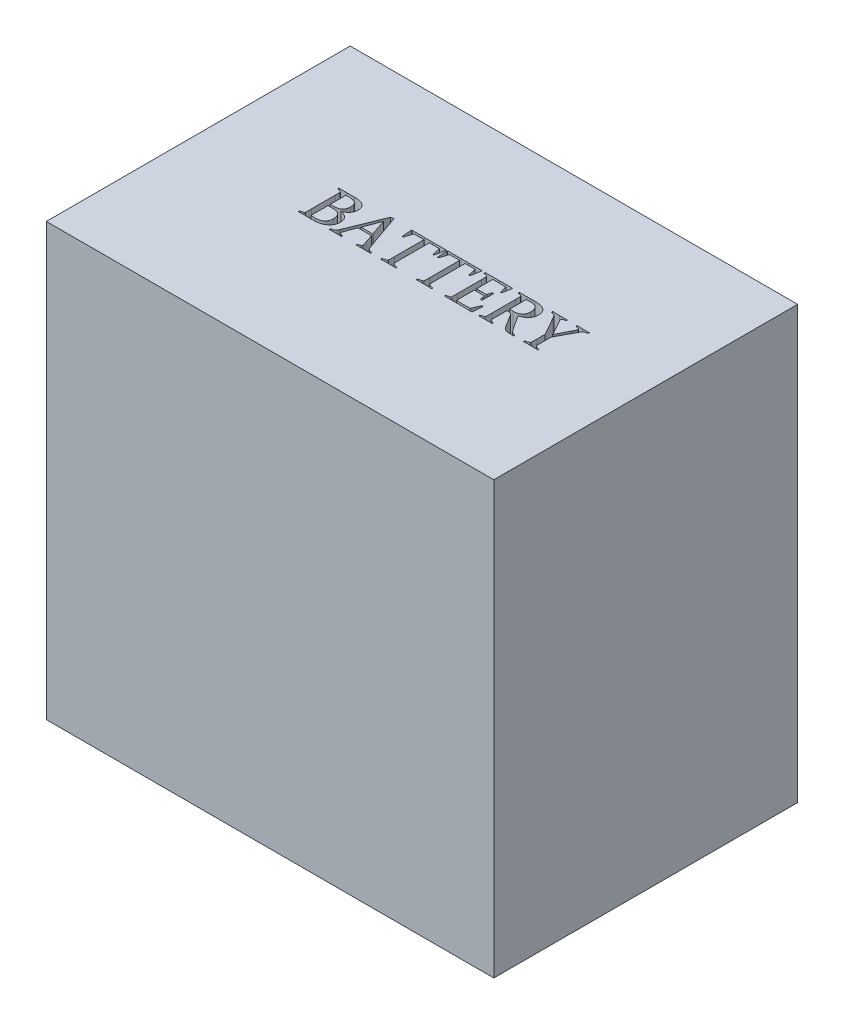
from build123d import *

# Parameters (mm, degrees)
SKETCH1_W           = 140
SKETCH1_H           = 95.06
BOSS_EXTRUDE1_DEPTH = 135
CUT_EXTRUDE1_DEPTH  = 10


with BuildPart() as part:
    # Sketch1 → Boss-Extrude1 (new body)
    with BuildSketch(Plane(origin=(0, 0, 0), x_dir=(1, 0, 0), z_dir=(0, 1, 0))):
        with Locations((-34.524886878, -45.795791855)):
            Rectangle(SKETCH1_W, SKETCH1_H)
    extrude(amount=BOSS_EXTRUDE1_DEPTH)

    # Sketch3 → Cut-Extrude1 (cut)
    # profile 1 of 7: a face of its own
    with BuildSketch(Plane(origin=(0, 135, 0), x_dir=(1, 0, 0), z_dir=(0, 1, 0))):
        with BuildLine():
            add(Edge.make_bspline(
                [(-67.809019882, -38.536040297), (-67.427547121, -38.546417855), (-66.669108469, -38.567050367), (-65.910393126, -38.569341939), (-65.533289712, -38.570480917)],
                knots=[0, 0, 0, 0, 1.005942301, 2, 2, 2, 2], degree=3))
            add(Edge.make_bspline(
                [(-65.533289712, -38.570480917), (-65.451169222, -38.567544733), (-65.264892055, -38.560884471), (-64.953094953, -38.557151408), (-64.57514416, -38.551262412), (-64.155660359, -38.547033522), (-63.740624652, -38.540800795), (-63.380303502, -38.539506194), (-63.096843529, -38.535502588), (-62.934348381, -38.535880219), (-62.865466334, -38.536040297)],
                knots=[0, 0, 0, 0, 0.73913045, 1.676598947, 2.80468887, 4.139292672, 5.450067671, 6.538357173, 7.380406424, 8, 8, 8, 8], degree=3))
            add(Edge.make_bspline(
                [(-62.865466334, -38.536040297), (-62.703774907, -38.537430001), (-62.390525449, -38.540122314), (-61.936010606, -38.579154485), (-61.51145673, -38.636757738), (-61.11549324, -38.713545577), (-60.751950727, -38.820593897), (-60.417858436, -38.947108155), (-60.114448975, -39.097674369), (-59.842426737, -39.272850081), (-59.603227642, -39.47091103), (-59.389655057, -39.68488596), (-59.215935664, -39.926858102), (-59.067795267, -40.183925865), (-58.955693763, -40.464150085), (-58.877496749, -40.764124192), (-58.828406865, -41.084806574), (-58.822864742, -41.305236873), (-58.820018173, -41.418455228)],
                knots=[0, 0, 0, 0, 1.378203886, 2.670034086, 3.88606819, 5.030458177, 6.105049954, 7.113226739, 8.072889222, 8.987638, 9.864930817, 10.716848378, 11.557174684, 12.396758562, 13.241257251, 14.12154981, 15.035182359, 16, 16, 16, 16], degree=3))
            add(Edge.make_bspline(
                [(-58.820018173, -41.418455228), (-58.820908478, -41.510408625), (-58.822651146, -41.69039663), (-58.855124518, -41.95465016), (-58.896719198, -42.208981625), (-58.965856813, -42.450581441), (-59.045185739, -42.682889705), (-59.152216652, -42.900353287), (-59.268678788, -43.111588819), (-59.412009446, -43.306468355), (-59.567088476, -43.494858725), (-59.747673955, -43.665206173), (-59.939750318, -43.831257244), (-60.154115788, -43.982707642), (-60.386989663, -44.121775893), (-60.637761757, -44.252780371), (-60.906674727, -44.371789686), (-61.095284608, -44.438948204), (-61.191122367, -44.473073256)],
                knots=[0, 0, 0, 0, 1.057010299, 2.068973867, 3.05944387, 4.018196596, 4.956492417, 5.878980143, 6.802641909, 7.727364617, 8.657429372, 9.605791154, 10.578809353, 11.576753923, 12.620399978, 13.697337371, 14.829955113, 16, 16, 16, 16], degree=3))
            add(Edge.make_bspline(
                [(-61.191122367, -44.473073256), (-61.078616777, -44.493539302), (-60.858163497, -44.533642261), (-60.540869206, -44.61966028), (-60.242552593, -44.719019596), (-59.965316303, -44.839048116), (-59.708370188, -44.976515321), (-59.470457364, -45.13112253), (-59.252059911, -45.303007191), (-59.057015689, -45.494737075), (-58.879663425, -45.69850536), (-58.730153546, -45.919869868), (-58.597763617, -46.151517817), (-58.491555036, -46.398404672), (-58.413000303, -46.660259651), (-58.354917674, -46.934917554), (-58.315856557, -47.222791096), (-58.312870836, -47.419823984), (-58.311356715, -47.519743449)],
                knots=[0, 0, 0, 0, 1.187931728, 2.327737193, 3.413187731, 4.453183684, 5.463269064, 6.438220556, 7.398548252, 8.346117218, 9.276870068, 10.200947513, 11.117336382, 12.046458873, 12.987068854, 13.953690983, 14.962274252, 16, 16, 16, 16], degree=3))
            add(Edge.make_bspline(
                [(-58.311356715, -47.519743449), (-58.315455324, -47.663906306), (-58.323464481, -47.945617211), (-58.385222602, -48.356283724), (-58.487591687, -48.742681266), (-58.634536307, -49.102765096), (-58.821657173, -49.437741294), (-59.050786461, -49.747298609), (-59.3244488, -50.028743356), (-59.634616468, -50.286578643), (-59.98343952, -50.513191887), (-60.363448821, -50.713141377), (-60.776888122, -50.878919717), (-61.221252479, -51.017865636), (-61.69857691, -51.121328396), (-62.207208779, -51.198902245), (-62.747228976, -51.243155497), (-63.117952305, -51.249385008), (-63.307895831, -51.252576755)],
                knots=[0, 0, 0, 0, 0.981867809, 1.918683317, 2.822078413, 3.699124559, 4.561079493, 5.429873538, 6.31493128, 7.229318538, 8.172142545, 9.1436515, 10.15029445, 11.202629439, 12.312014813, 13.474334065, 14.705951703, 16, 16, 16, 16], degree=3))
            add(Edge.make_bspline(
                [(-63.307895831, -51.252576755), (-63.46950963, -51.252288886), (-63.806017329, -51.251689494), (-64.334035588, -51.238597476), (-64.915069564, -51.226400232), (-65.321339055, -51.226193285), (-65.53593899, -51.226083971)],
                knots=[0, 0, 0, 0, 0.870320471, 1.812156761, 2.844336023, 4, 4, 4, 4], degree=3))
            add(Edge.make_bspline(
                [(-65.53593899, -51.226083971), (-65.905970003, -51.226565663), (-66.652275977, -51.227537175), (-67.398397366, -51.244183804), (-67.774579262, -51.252576755)],
                knots=[0, 0, 0, 0, 0.991633528, 2, 2, 2, 2], degree=3))
            Line((-67.774579262, -51.252576755), (-67.809019882, -50.913469116))
            Line((-67.809019882, -50.913469116), (-66.709569334, -50.574361478))
            add(Edge.make_bspline(
                [(-66.709569334, -50.574361478), (-66.675942332, -50.562088632), (-66.612088416, -50.538783872), (-66.534063804, -50.475564404), (-66.482006467, -50.390399903), (-66.473146081, -50.325191923), (-66.468484997, -50.290888686)],
                knots=[0, 0, 0, 0, 1.072356029, 2.036284212, 2.966969876, 4, 4, 4, 4], degree=3))
            add(Edge.make_bspline(
                [(-66.468484997, -50.290888686), (-66.465555591, -50.161961552), (-66.459376186, -49.889997577), (-66.455510446, -49.459012658), (-66.448317011, -48.982164606), (-66.44938214, -48.648339378), (-66.449940048, -48.473483684)],
                knots=[0, 0, 0, 0, 0.851424291, 1.796027954, 2.845572385, 4, 4, 4, 4], degree=3))
            Line((-66.449940048, -48.473483684), (-66.449940048, -41.06080264))
            add(Edge.make_bspline(
                [(-66.449940048, -41.06080264), (-66.449371916, -40.913322078), (-66.44829344, -40.633362171), (-66.455513156, -40.234230992), (-66.459354675, -39.875651885), (-66.465554368, -39.649614983), (-66.468484997, -39.5427661)],
                knots=[0, 0, 0, 0, 1.165661162, 2.212755269, 3.155159611, 4, 4, 4, 4], degree=3))
            add(Edge.make_bspline(
                [(-66.468484997, -39.5427661), (-66.471341905, -39.505942968), (-66.476727369, -39.436528909), (-66.522648151, -39.344665725), (-66.590420393, -39.270774565), (-66.651655601, -39.245678032), (-66.68307655, -39.232800524)],
                knots=[0, 0, 0, 0, 1.089053236, 2.052937975, 3.000925474, 4, 4, 4, 4], degree=3))
            Line((-66.68307655, -39.232800524), (-67.790474933, -38.875147936))
            Line((-67.790474933, -38.875147936), (-67.809019882, -38.536040297))
        make_face()
        with BuildLine():
            Line((-64.754401853, -44.979085436), (-64.754401853, -50.256448066))
            add(Edge.make_bspline(
                [(-64.754401853, -50.256448066), (-64.65605006, -50.284658389), (-64.447929201, -50.34435386), (-64.116843115, -50.382381639), (-63.78142988, -50.397938133), (-63.55959909, -50.402586583), (-63.453606145, -50.404807658)],
                knots=[0, 0, 0, 0, 0.932933746, 1.974168104, 3.032037493, 4, 4, 4, 4], degree=3))
            add(Edge.make_bspline(
                [(-63.453606145, -50.404807658), (-63.330767627, -50.403124731), (-63.091639932, -50.399848604), (-62.744625017, -50.364433136), (-62.419650166, -50.309173621), (-62.116571324, -50.233924872), (-61.83739735, -50.13262053), (-61.580072944, -50.010641728), (-61.346449996, -49.864621599), (-61.135430096, -49.69694897), (-60.948639857, -49.507469505), (-60.786443761, -49.297722805), (-60.650069368, -49.066964092), (-60.539416024, -48.816814182), (-60.450634929, -48.547351348), (-60.391446195, -48.256565414), (-60.353632767, -47.946388047), (-60.348589495, -47.73268453), (-60.346002548, -47.623065308)],
                knots=[0, 0, 0, 0, 1.238057209, 2.410105338, 3.512269806, 4.559560237, 5.553733266, 6.501495605, 7.425414509, 8.325034372, 9.212724115, 10.101350968, 10.991537483, 11.9081781, 12.854182454, 13.846000613, 14.895105975, 16, 16, 16, 16], degree=3))
            add(Edge.make_bspline(
                [(-60.346002548, -47.623065308), (-60.348666269, -47.513466888), (-60.353837904, -47.300680758), (-60.390188275, -46.99261248), (-60.454165101, -46.707042144), (-60.54138696, -46.443090734), (-60.652717878, -46.199583246), (-60.790592681, -45.977805268), (-60.957241654, -45.780737435), (-61.146884547, -45.603583227), (-61.365399797, -45.448568437), (-61.612601292, -45.312285035), (-61.893430381, -45.203620437), (-62.202153165, -45.109610008), (-62.542989393, -45.040393906), (-62.913422688, -44.986464976), (-63.315433327, -44.959112307), (-63.59310161, -44.954818887), (-63.737078937, -44.952592652)],
                knots=[0, 0, 0, 0, 1.05999139, 2.057980992, 2.994616073, 3.885952831, 4.742010155, 5.578585574, 6.403171339, 7.231156379, 8.082085007, 8.988034817, 9.953965965, 10.988883383, 12.106237805, 13.314170885, 14.607336449, 16, 16, 16, 16], degree=3))
            add(Edge.make_bspline(
                [(-63.737078937, -44.952592652), (-63.90843494, -44.952984912), (-64.247753603, -44.953761665), (-64.586648806, -44.970700645), (-64.754401853, -44.979085436)],
                knots=[0, 0, 0, 0, 1.010000458, 2, 2, 2, 2], degree=3))
        make_face(mode=Mode.SUBTRACT)
        with BuildLine():
            add(Edge.make_bspline(
                [(-64.754401853, -44.292922323), (-64.562772242, -44.294910272), (-64.177753045, -44.29890443), (-63.79271534, -44.300212921), (-63.599316458, -44.300870158)],
                knots=[0, 0, 0, 0, 0.995428867, 2, 2, 2, 2], degree=3))
            add(Edge.make_bspline(
                [(-63.599316458, -44.300870158), (-63.489755054, -44.298676327), (-63.276415266, -44.294404464), (-62.967193463, -44.26605633), (-62.678234196, -44.215867258), (-62.410614699, -44.144489167), (-62.162982894, -44.054589507), (-61.935589601, -43.946248387), (-61.729902543, -43.815727805), (-61.546170365, -43.663882675), (-61.383694839, -43.49228408), (-61.23909712, -43.304521638), (-61.120074181, -43.09522154), (-61.021316985, -42.869924216), (-60.948054208, -42.624865793), (-60.891889207, -42.363768167), (-60.860488447, -42.083304966), (-60.856643088, -41.890984575), (-60.854664006, -41.792003486)],
                knots=[0, 0, 0, 0, 1.237178968, 2.409055454, 3.502577501, 4.545123155, 5.532558798, 6.47363837, 7.383776903, 8.276262588, 9.157930545, 10.047458661, 10.94544277, 11.869891171, 12.819334189, 13.828534526, 14.882416913, 16, 16, 16, 16], degree=3))
            add(Edge.make_bspline(
                [(-60.854664006, -41.792003486), (-60.856276096, -41.688570236), (-60.859386134, -41.489027096), (-60.895044492, -41.201010355), (-60.950057065, -40.934917185), (-61.025416047, -40.689596913), (-61.126835219, -40.468313975), (-61.249664009, -40.269070878), (-61.395865811, -40.093214037), (-61.565819318, -39.940833312), (-61.754868645, -39.808389449), (-61.962790296, -39.693934257), (-62.190537805, -39.598802907), (-62.437516591, -39.518711531), (-62.705703316, -39.459577656), (-62.992226357, -39.414119928), (-63.298556966, -39.387453357), (-63.509188234, -39.385049593), (-63.617861407, -39.383809394)],
                knots=[0, 0, 0, 0, 1.177231098, 2.271110987, 3.298638014, 4.268657357, 5.186615539, 6.062809601, 6.926742094, 7.781081906, 8.65432805, 9.549983417, 10.478238827, 11.460894017, 12.502544614, 13.601957102, 14.762752866, 16, 16, 16, 16], degree=3))
            add(Edge.make_bspline(
                [(-63.617861407, -39.383809394), (-63.700883994, -39.384179564), (-63.874941562, -39.384955627), (-64.146980935, -39.396749909), (-64.443183193, -39.413782186), (-64.647625969, -39.435860873), (-64.754401853, -39.447392077)],
                knots=[0, 0, 0, 0, 0.874677504, 1.83376891, 2.868626, 4, 4, 4, 4], degree=3))
            Line((-64.754401853, -39.447392077), (-64.754401853, -44.292922323))
        make_face(mode=Mode.SUBTRACT)
    # profile 2 of 7: a face of its own
    with BuildSketch(Plane(origin=(0, 135, 0), x_dir=(1, 0, 0), z_dir=(0, 1, 0))):
        with BuildLine():
            Line((-50.890727835, -38.196932658), (-46.922108749, -49.459015259))
            add(Edge.make_bspline(
                [(-46.922108749, -49.459015259), (-46.885663146, -49.556391089), (-46.818572642, -49.735644359), (-46.71727249, -49.97893096), (-46.617774069, -50.169388956), (-46.52207984, -50.317727821), (-46.415151059, -50.430782604), (-46.290833352, -50.520236854), (-46.149463946, -50.598234463), (-46.045791974, -50.636640187), (-45.992212021, -50.656489109)],
                knots=[0, 0, 0, 0, 1.574516787, 2.898432601, 3.987097625, 4.825290635, 5.56306803, 6.327976849, 7.135861677, 8, 8, 8, 8], degree=3))
            Line((-45.992212021, -50.656489109), (-45.14974148, -50.913469116))
            Line((-45.14974148, -50.913469116), (-45.13384581, -51.252576755))
            add(Edge.make_bspline(
                [(-45.13384581, -51.252576755), (-45.325480074, -51.249283394), (-45.70168619, -51.242818045), (-46.255315735, -51.229235603), (-46.787885158, -51.229307688), (-47.13581929, -51.227143899), (-47.306254121, -51.226083971)],
                knots=[0, 0, 0, 0, 1.058612849, 2.078212005, 3.058616038, 4, 4, 4, 4], degree=3))
            add(Edge.make_bspline(
                [(-47.306254121, -51.226083971), (-47.483754084, -51.227132376), (-47.853766087, -51.229317855), (-48.432247844, -51.229365395), (-49.056530067, -51.243051412), (-49.488373005, -51.249328915), (-49.711798935, -51.252576755)],
                knots=[0, 0, 0, 0, 0.885404967, 1.84569315, 2.885409556, 4, 4, 4, 4], degree=3))
            Line((-49.711798935, -51.252576755), (-49.746239554, -50.913469116))
            Line((-49.746239554, -50.913469116), (-48.898470457, -50.645891995))
            add(Edge.make_bspline(
                [(-48.898470457, -50.645891995), (-48.846417956, -50.624085931), (-48.755473136, -50.585986925), (-48.638131491, -50.50604919), (-48.572638726, -50.383620697), (-48.569216995, -50.291741085), (-48.567310653, -50.240552396)],
                knots=[0, 0, 0, 0, 1.191052092, 2.08097623, 2.930858445, 4, 4, 4, 4], degree=3))
            add(Edge.make_bspline(
                [(-48.567310653, -50.240552396), (-48.572947489, -50.165975309), (-48.58588283, -49.994836742), (-48.652354838, -49.773201628), (-48.714787482, -49.559195484), (-48.776571081, -49.365094737), (-48.848566327, -49.145662807), (-48.898557426, -48.990123051), (-48.924963241, -48.907965346)],
                knots=[0, 0, 0, 0, 0.970738523, 2.227638644, 2.994762933, 3.874229025, 4.877145812, 6, 6, 6, 6], degree=3))
            Line((-48.924963241, -48.907965346), (-49.764784503, -46.335515991))
            Line((-49.764784503, -46.335515991), (-54.075160507, -46.335515991))
            Line((-54.075160507, -46.335515991), (-55.013005071, -48.907965346))
            add(Edge.make_bspline(
                [(-55.013005071, -48.907965346), (-55.043443713, -48.993482262), (-55.100759002, -49.154508717), (-55.175727685, -49.384794235), (-55.248445012, -49.583904019), (-55.30857445, -49.758239647), (-55.353100293, -49.910604503), (-55.390319952, -50.043102204), (-55.408792127, -50.16057938), (-55.413516894, -50.233447242), (-55.415695392, -50.26704518)],
                knots=[0, 0, 0, 0, 1.53230722, 2.885300472, 4.087661103, 5.110660653, 5.997387815, 6.767555662, 7.431744164, 8, 8, 8, 8], degree=3))
            add(Edge.make_bspline(
                [(-55.415695392, -50.26704518), (-55.412958036, -50.315859519), (-55.407924413, -50.405622406), (-55.334909342, -50.522500589), (-55.218034627, -50.600003531), (-55.12690818, -50.6346873), (-55.076587753, -50.65383983)],
                knots=[0, 0, 0, 0, 1.036269142, 1.905557071, 2.843439335, 4, 4, 4, 4], degree=3))
            Line((-55.076587753, -50.65383983), (-54.244714326, -50.913469116))
            Line((-54.244714326, -50.913469116), (-54.226169377, -51.252576755))
            add(Edge.make_bspline(
                [(-54.226169377, -51.252576755), (-54.428402486, -51.249383273), (-54.812563624, -51.243316948), (-55.360003404, -51.229442517), (-55.849300338, -51.229348629), (-56.156612074, -51.227125341), (-56.300554387, -51.226083971)],
                knots=[0, 0, 0, 0, 1.169919131, 2.222373308, 3.16737414, 4, 4, 4, 4], degree=3))
            add(Edge.make_bspline(
                [(-56.300554387, -51.226083971), (-56.438314442, -51.227139717), (-56.721781928, -51.229312114), (-57.15898978, -51.229280213), (-57.619878998, -51.242911381), (-57.935155059, -51.249301294), (-58.096765162, -51.252576755)],
                knots=[0, 0, 0, 0, 0.920242704, 1.893574212, 2.920248855, 4, 4, 4, 4], degree=3))
            Line((-58.096765162, -51.252576755), (-58.141802895, -50.913469116))
            Line((-58.141802895, -50.913469116), (-57.238398951, -50.627347046))
            add(Edge.make_bspline(
                [(-57.238398951, -50.627347046), (-57.184475776, -50.609052337), (-57.080899193, -50.573911536), (-56.946307994, -50.490931843), (-56.827133897, -50.402338232), (-56.734518486, -50.285978373), (-56.653174352, -50.147505975), (-56.560107731, -49.986754325), (-56.473542851, -49.788283513), (-56.412616319, -49.646246507), (-56.38003274, -49.570284953)],
                knots=[0, 0, 0, 0, 0.960439586, 1.844829266, 2.664180003, 3.460297701, 4.339620655, 5.383436748, 6.600658962, 8, 8, 8, 8], degree=3))
            Line((-56.38003274, -49.570284953), (-51.812676729, -38.334695136))
            Line((-51.812676729, -38.334695136), (-50.890727835, -38.196932658))
        make_face()
        Polygon((-53.744000703, -45.657300714), (-50.058854409, -45.657300714), (-51.802079615, -40.599828193), align=None, mode=Mode.SUBTRACT)
    # profile 3 of 7: a face of its own
    with BuildSketch(Plane(origin=(0, 135, 0), x_dir=(1, 0, 0), z_dir=(0, 1, 0))):
        with BuildLine():
            add(Edge.make_bspline(
                [(-39.641891627, -51.226083971), (-39.826456241, -51.227137109), (-40.205299181, -51.229298811), (-40.790846489, -51.22931791), (-41.408065797, -51.242879996), (-41.831075724, -51.249295407), (-42.04743644, -51.252576755)],
                knots=[0, 0, 0, 0, 0.920642888, 1.889739583, 2.920646004, 4, 4, 4, 4], degree=3))
            Line((-42.04743644, -51.252576755), (-42.08187706, -50.913469116))
            Line((-42.08187706, -50.913469116), (-40.759887124, -50.508129517))
            add(Edge.make_bspline(
                [(-40.759887124, -50.508129517), (-40.726240452, -50.495956108), (-40.661812626, -50.472646038), (-40.584410998, -50.408074642), (-40.538290198, -50.320246307), (-40.530757514, -50.25611897), (-40.526750622, -50.222007447)],
                knots=[0, 0, 0, 0, 1.07619582, 2.060737424, 2.968439932, 4, 4, 4, 4], degree=3))
            add(Edge.make_bspline(
                [(-40.526750622, -50.222007447), (-40.523817632, -50.096612849), (-40.517580345, -49.829949051), (-40.513784791, -49.406026827), (-40.506567751, -48.933594867), (-40.507641575, -48.602418646), (-40.508205673, -48.42844595)],
                knots=[0, 0, 0, 0, 0.839114093, 1.784457676, 2.836136637, 4, 4, 4, 4], degree=3))
            Line((-40.508205673, -48.42844595), (-40.508205673, -39.214255575))
            Line((-40.508205673, -39.214255575), (-43.66614556, -39.214255575))
            Line((-43.66614556, -39.214255575), (-44.460929089, -41.760212145))
            Line((-44.460929089, -41.760212145), (-44.818581677, -41.826444106))
            Line((-44.818581677, -41.826444106), (-45.051718178, -38.573130195))
            Line((-45.051718178, -38.573130195), (-44.988135496, -38.501599677))
            add(Edge.make_bspline(
                [(-44.988135496, -38.501599677), (-44.625189054, -38.507242887), (-43.907264153, -38.518405417), (-42.842238874, -38.528962511), (-41.801057851, -38.533779174), (-41.11489076, -38.535292434), (-40.775782794, -38.536040297)],
                knots=[0, 0, 0, 0, 1.034026858, 2.045353098, 3.034001568, 4, 4, 4, 4], degree=3))
            Line((-40.775782794, -38.536040297), (-38.444417777, -38.536040297))
            add(Edge.make_bspline(
                [(-38.444417777, -38.536040297), (-38.106192912, -38.535290356), (-37.420025856, -38.533768927), (-36.377078676, -38.528957489), (-35.305872414, -38.518366881), (-34.582648306, -38.507238669), (-34.216169404, -38.501599677)],
                knots=[0, 0, 0, 0, 0.95986119, 1.947299551, 2.95983638, 4, 4, 4, 4], degree=3))
            Line((-34.216169404, -38.501599677), (-34.163183836, -38.573130195))
            Line((-34.163183836, -38.573130195), (-34.724830863, -41.762861423))
            Line((-34.724830863, -41.762861423), (-35.082483451, -41.826444106))
            Line((-35.082483451, -41.826444106), (-35.654727591, -39.214255575))
            Line((-35.654727591, -39.214255575), (-38.812667478, -39.214255575))
            Line((-38.812667478, -39.214255575), (-38.812667478, -48.42844595))
            add(Edge.make_bspline(
                [(-38.812667478, -48.42844595), (-38.813231577, -48.602418646), (-38.8143054, -48.933594867), (-38.80708836, -49.406026827), (-38.803292806, -49.829949051), (-38.797055519, -50.096612849), (-38.794122529, -50.222007447)],
                knots=[0, 0, 0, 0, 1.163863363, 2.215542324, 3.160885907, 4, 4, 4, 4], degree=3))
            add(Edge.make_bspline(
                [(-38.794122529, -50.222007447), (-38.790401467, -50.256298795), (-38.783359717, -50.321191846), (-38.733343407, -50.406365828), (-38.659141201, -50.473567109), (-38.594877685, -50.496195584), (-38.560986028, -50.508129517)],
                knots=[0, 0, 0, 0, 1.033432821, 1.955671374, 2.921850393, 4, 4, 4, 4], degree=3))
            Line((-38.560986028, -50.508129517), (-37.238996092, -50.913469116))
            Line((-37.238996092, -50.913469116), (-37.220451143, -51.252576755))
            add(Edge.make_bspline(
                [(-37.220451143, -51.252576755), (-37.443876967, -51.249322752), (-37.87660257, -51.24302048), (-38.503534708, -51.229350123), (-39.087314912, -51.229315499), (-39.461742397, -51.227133704), (-39.641891627, -51.226083971)],
                knots=[0, 0, 0, 0, 1.107274464, 2.144541755, 3.107278743, 4, 4, 4, 4], degree=3))
        make_face()
    # profile 4 of 7: a face of its own
    with BuildSketch(Plane(origin=(0, 135, 0), x_dir=(1, 0, 0), z_dir=(0, 1, 0))):
        with BuildLine():
            add(Edge.make_bspline(
                [(-28.451339543, -51.226083971), (-28.635904158, -51.227137109), (-29.014747097, -51.229298811), (-29.600294405, -51.22931791), (-30.217513713, -51.242879996), (-30.64052364, -51.249295407), (-30.856884357, -51.252576755)],
                knots=[0, 0, 0, 0, 0.920642888, 1.889739583, 2.920646004, 4, 4, 4, 4], degree=3))
            Line((-30.856884357, -51.252576755), (-30.891324976, -50.913469116))
            Line((-30.891324976, -50.913469116), (-29.56933504, -50.508129517))
            add(Edge.make_bspline(
                [(-29.56933504, -50.508129517), (-29.535688368, -50.495956108), (-29.471260543, -50.472646038), (-29.393858915, -50.408074642), (-29.347738114, -50.320246307), (-29.340205431, -50.25611897), (-29.336198539, -50.222007447)],
                knots=[0, 0, 0, 0, 1.07619582, 2.060737424, 2.968439932, 4, 4, 4, 4], degree=3))
            add(Edge.make_bspline(
                [(-29.336198539, -50.222007447), (-29.333265549, -50.096612849), (-29.327028262, -49.829949051), (-29.323232708, -49.406026827), (-29.316015668, -48.933594867), (-29.317089491, -48.602418646), (-29.31765359, -48.42844595)],
                knots=[0, 0, 0, 0, 0.839114093, 1.784457676, 2.836136637, 4, 4, 4, 4], degree=3))
            Line((-29.31765359, -48.42844595), (-29.31765359, -39.214255575))
            Line((-29.31765359, -39.214255575), (-32.475593477, -39.214255575))
            Line((-32.475593477, -39.214255575), (-33.270377005, -41.760212145))
            Line((-33.270377005, -41.760212145), (-33.628029593, -41.826444106))
            Line((-33.628029593, -41.826444106), (-33.861166095, -38.573130195))
            Line((-33.861166095, -38.573130195), (-33.797583413, -38.501599677))
            add(Edge.make_bspline(
                [(-33.797583413, -38.501599677), (-33.434636971, -38.507242887), (-32.71671207, -38.518405417), (-31.65168679, -38.528962511), (-30.610505768, -38.533779174), (-29.924338677, -38.535292434), (-29.585230711, -38.536040297)],
                knots=[0, 0, 0, 0, 1.034026858, 2.045353098, 3.034001568, 4, 4, 4, 4], degree=3))
            Line((-29.585230711, -38.536040297), (-27.253865693, -38.536040297))
            add(Edge.make_bspline(
                [(-27.253865693, -38.536040297), (-26.915640829, -38.535290356), (-26.229473773, -38.533768927), (-25.186526593, -38.528957489), (-24.115320331, -38.518366881), (-23.392096223, -38.507238669), (-23.025617321, -38.501599677)],
                knots=[0, 0, 0, 0, 0.95986119, 1.947299551, 2.95983638, 4, 4, 4, 4], degree=3))
            Line((-23.025617321, -38.501599677), (-22.972631753, -38.573130195))
            Line((-22.972631753, -38.573130195), (-23.534278779, -41.762861423))
            Line((-23.534278779, -41.762861423), (-23.891931367, -41.826444106))
            Line((-23.891931367, -41.826444106), (-24.464175508, -39.214255575))
            Line((-24.464175508, -39.214255575), (-27.622115395, -39.214255575))
            Line((-27.622115395, -39.214255575), (-27.622115395, -48.42844595))
            add(Edge.make_bspline(
                [(-27.622115395, -48.42844595), (-27.622679493, -48.602418646), (-27.623753317, -48.933594867), (-27.616536277, -49.406026827), (-27.612740723, -49.829949051), (-27.606503436, -50.096612849), (-27.603570446, -50.222007447)],
                knots=[0, 0, 0, 0, 1.163863363, 2.215542324, 3.160885907, 4, 4, 4, 4], degree=3))
            add(Edge.make_bspline(
                [(-27.603570446, -50.222007447), (-27.599849383, -50.256298795), (-27.592807633, -50.321191846), (-27.542791324, -50.406365828), (-27.468589118, -50.473567109), (-27.404325601, -50.496195584), (-27.370433944, -50.508129517)],
                knots=[0, 0, 0, 0, 1.033432821, 1.955671374, 2.921850393, 4, 4, 4, 4], degree=3))
            Line((-27.370433944, -50.508129517), (-26.048444008, -50.913469116))
            Line((-26.048444008, -50.913469116), (-26.029899059, -51.252576755))
            add(Edge.make_bspline(
                [(-26.029899059, -51.252576755), (-26.253324884, -51.249322752), (-26.686050487, -51.24302048), (-27.312982625, -51.229350123), (-27.896762829, -51.229315499), (-28.271190313, -51.227133704), (-28.451339543, -51.226083971)],
                knots=[0, 0, 0, 0, 1.107274464, 2.144541755, 3.107278743, 4, 4, 4, 4], degree=3))
        make_face()
    # profile 5 of 7: a face of its own
    with BuildSketch(Plane(origin=(0, 135, 0), x_dir=(1, 0, 0), z_dir=(0, 1, 0))):
        with BuildLine():
            Line((-19.84118465, -38.536040297), (-17.695269122, -38.536040297))
            add(Edge.make_bspline(
                [(-17.695269122, -38.536040297), (-17.357044258, -38.535290356), (-16.670877202, -38.533768927), (-15.627930022, -38.528957489), (-14.55672376, -38.518366881), (-13.833499652, -38.507238669), (-13.46702075, -38.501599677)],
                knots=[0, 0, 0, 0, 0.95986119, 1.947299551, 2.95983638, 4, 4, 4, 4], degree=3))
            Line((-13.46702075, -38.501599677), (-13.411385903, -38.573130195))
            Line((-13.411385903, -38.573130195), (-13.930644475, -41.418455228))
            Line((-13.930644475, -41.418455228), (-14.288297063, -41.479388631))
            Line((-14.288297063, -41.479388631), (-14.841996254, -39.214255575))
            Line((-14.841996254, -39.214255575), (-18.974870603, -39.214255575))
            Line((-18.974870603, -39.214255575), (-18.974870603, -44.300870158))
            Line((-18.974870603, -44.300870158), (-18.161542126, -44.300870158))
            add(Edge.make_bspline(
                [(-18.161542126, -44.300870158), (-18.001699314, -44.301394222), (-17.674056409, -44.302468439), (-17.168964868, -44.293940117), (-16.637292436, -44.294533173), (-16.273484362, -44.288211952), (-16.087157116, -44.284974488)],
                knots=[0, 0, 0, 0, 0.924608237, 1.895245239, 2.922032839, 4, 4, 4, 4], degree=3))
            add(Edge.make_bspline(
                [(-16.087157116, -44.284974488), (-16.051288761, -44.281949128), (-15.982898129, -44.276180639), (-15.891818244, -44.231608705), (-15.819863627, -44.161530193), (-15.795339237, -44.099981209), (-15.782490097, -44.067733656)],
                knots=[0, 0, 0, 0, 1.068716211, 2.037734312, 2.971903963, 4, 4, 4, 4], degree=3))
            Line((-15.782490097, -44.067733656), (-15.469875242, -42.944439603))
            Line((-15.469875242, -42.944439603), (-14.98505729, -42.925894654))
            add(Edge.make_bspline(
                [(-14.98505729, -42.925894654), (-14.989825663, -43.119285069), (-14.998686888, -43.478668881), (-15.0058995, -43.97676763), (-15.011730101, -44.393583916), (-15.013436362, -44.644392014), (-15.014199352, -44.756546048)],
                knots=[0, 0, 0, 0, 1.267879065, 2.356141637, 3.264914697, 4, 4, 4, 4], degree=3))
            add(Edge.make_bspline(
                [(-15.014199352, -44.756546048), (-15.013432171, -44.866050781), (-15.011705966, -45.112443374), (-15.005894611, -45.523078085), (-14.998677848, -46.015878503), (-14.989824678, -46.371729755), (-14.98505729, -46.563353936)],
                knots=[0, 0, 0, 0, 0.727191112, 1.636226109, 2.727119176, 4, 4, 4, 4], degree=3))
            Line((-14.98505729, -46.563353936), (-15.469875242, -46.597794556))
            Line((-15.469875242, -46.597794556), (-15.790437932, -45.262558228))
            add(Edge.make_bspline(
                [(-15.790437932, -45.262558228), (-15.803570048, -45.224602561), (-15.827889673, -45.154311715), (-15.889599353, -45.067566546), (-15.972726455, -45.011200036), (-16.035999298, -45.002245726), (-16.068612167, -44.997630385)],
                knots=[0, 0, 0, 0, 1.165841965, 2.159045699, 3.051112636, 4, 4, 4, 4], degree=3))
            add(Edge.make_bspline(
                [(-16.068612167, -44.997630385), (-16.257591149, -44.994716789), (-16.626709278, -44.989025886), (-17.16630229, -44.985129361), (-17.677590655, -44.977707505), (-18.008764632, -44.978635205), (-18.169489961, -44.979085436)],
                knots=[0, 0, 0, 0, 1.079495133, 2.108494915, 3.082014899, 4, 4, 4, 4], degree=3))
            Line((-18.169489961, -44.979085436), (-18.974870603, -44.979085436))
            Line((-18.974870603, -44.979085436), (-18.974870603, -48.473483684))
            add(Edge.make_bspline(
                [(-18.974870603, -48.473483684), (-18.973784911, -48.825843738), (-18.971627058, -49.526171952), (-18.961404754, -50.226428785), (-18.956325654, -50.574361478)],
                knots=[0, 0, 0, 0, 1.006271195, 2, 2, 2, 2], degree=3))
            Line((-18.956325654, -50.574361478), (-14.6644946, -50.574361478))
            Line((-14.6644946, -50.574361478), (-13.572991887, -48.094636868))
            Line((-13.572991887, -48.094636868), (-13.170301566, -48.023106351))
            Line((-13.170301566, -48.023106351), (-13.368997448, -51.215486857))
            Line((-13.368997448, -51.215486857), (-13.429930852, -51.27906954))
            add(Edge.make_bspline(
                [(-13.429930852, -51.27906954), (-13.808779317, -51.275783282), (-14.55058192, -51.269348639), (-15.641165757, -51.255726481), (-16.686780454, -51.255804115), (-17.369408932, -51.253636653), (-17.703216958, -51.252576755)],
                knots=[0, 0, 0, 0, 1.063875567, 2.083116964, 3.062636615, 4, 4, 4, 4], degree=3))
            Line((-17.703216958, -51.252576755), (-19.804094752, -51.252576755))
            add(Edge.make_bspline(
                [(-19.804094752, -51.252576755), (-20.162630432, -51.252576755), (-20.892948186, -51.252576755), (-21.623265939, -51.252576755), (-21.995048012, -51.252576755)],
                knots=[0, 0, 0, 0, 0.981862152, 2, 2, 2, 2], degree=3))
            Line((-21.995048012, -51.252576755), (-22.029488632, -50.913469116))
            Line((-22.029488632, -50.913469116), (-20.930038084, -50.574361478))
            add(Edge.make_bspline(
                [(-20.930038084, -50.574361478), (-20.896411082, -50.562088632), (-20.832557166, -50.538783872), (-20.754532554, -50.475564404), (-20.702475217, -50.390399903), (-20.693614831, -50.325191923), (-20.688953747, -50.290888686)],
                knots=[0, 0, 0, 0, 1.072356029, 2.036284212, 2.966969876, 4, 4, 4, 4], degree=3))
            add(Edge.make_bspline(
                [(-20.688953747, -50.290888686), (-20.686024341, -50.161961552), (-20.679844936, -49.889997577), (-20.675979196, -49.459012658), (-20.668785761, -48.982164606), (-20.66985089, -48.648339378), (-20.670408798, -48.473483684)],
                knots=[0, 0, 0, 0, 0.851424291, 1.796027954, 2.845572385, 4, 4, 4, 4], degree=3))
            Line((-20.670408798, -48.473483684), (-20.670408798, -41.06080264))
            add(Edge.make_bspline(
                [(-20.670408798, -41.06080264), (-20.669840666, -40.913322078), (-20.66876219, -40.633362171), (-20.675981906, -40.234230992), (-20.679823425, -39.875651885), (-20.686023118, -39.649614983), (-20.688953747, -39.5427661)],
                knots=[0, 0, 0, 0, 1.165661162, 2.212755269, 3.155159611, 4, 4, 4, 4], degree=3))
            add(Edge.make_bspline(
                [(-20.688953747, -39.5427661), (-20.691810655, -39.505942968), (-20.697196119, -39.436528909), (-20.743116901, -39.344665725), (-20.810889143, -39.270774565), (-20.872124351, -39.245678032), (-20.9035453, -39.232800524)],
                knots=[0, 0, 0, 0, 1.089053236, 2.052937975, 3.000925474, 4, 4, 4, 4], degree=3))
            Line((-20.9035453, -39.232800524), (-22.010943683, -38.875147936))
            Line((-22.010943683, -38.875147936), (-22.029488632, -38.536040297))
            add(Edge.make_bspline(
                [(-22.029488632, -38.536040297), (-21.655057281, -38.536040297), (-20.92562262, -38.536040297), (-20.196187959, -38.536040297), (-19.84118465, -38.536040297)],
                knots=[0, 0, 0, 0, 1.026634383, 2, 2, 2, 2], degree=3))
        make_face()
    # profile 6 of 7: a face of its own
    with BuildSketch(Plane(origin=(0, 135, 0), x_dir=(1, 0, 0), z_dir=(0, 1, 0))):
        with BuildLine():
            add(Edge.make_bspline(
                [(-8.292979978, -48.54766348), (-8.292058725, -48.715450885), (-8.29030834, -49.034247446), (-8.288404504, -49.488170214), (-8.283332303, -49.896179446), (-8.277297243, -50.153130348), (-8.274435029, -50.274993015)],
                knots=[0, 0, 0, 0, 1.16556873, 2.214583996, 3.153240739, 4, 4, 4, 4], degree=3))
            add(Edge.make_bspline(
                [(-8.274435029, -50.274993015), (-8.270598777, -50.31700174), (-8.26340171, -50.39581292), (-8.217494154, -50.501377333), (-8.141858175, -50.582194101), (-8.075440402, -50.608517182), (-8.041298528, -50.622048489)],
                knots=[0, 0, 0, 0, 1.12342583, 2.107622107, 3.027228327, 4, 4, 4, 4], degree=3))
            Line((-8.041298528, -50.622048489), (-7.050468395, -50.913469116))
            Line((-7.050468395, -50.913469116), (-7.021326333, -51.252576755))
            add(Edge.make_bspline(
                [(-7.021326333, -51.252576755), (-7.373663688, -51.244184621), (-8.073857714, -51.227507075), (-8.774249306, -51.226556311), (-9.122204127, -51.226083971)],
                knots=[0, 0, 0, 0, 1.006399206, 2, 2, 2, 2], degree=3))
            add(Edge.make_bspline(
                [(-9.122204127, -51.226083971), (-9.480754624, -51.226611718), (-10.211165165, -51.227686803), (-10.941391251, -51.244179925), (-11.313157387, -51.252576755)],
                knots=[0, 0, 0, 0, 0.98177799, 2, 2, 2, 2], degree=3))
            Line((-11.313157387, -51.252576755), (-11.347598007, -50.913469116))
            Line((-11.347598007, -50.913469116), (-10.248147459, -50.574361478))
            add(Edge.make_bspline(
                [(-10.248147459, -50.574361478), (-10.214520457, -50.562088632), (-10.150666541, -50.538783872), (-10.072641929, -50.475564404), (-10.020584592, -50.390399903), (-10.011724206, -50.325191923), (-10.007063122, -50.290888686)],
                knots=[0, 0, 0, 0, 1.072356029, 2.036284212, 2.966969876, 4, 4, 4, 4], degree=3))
            add(Edge.make_bspline(
                [(-10.007063122, -50.290888686), (-10.004133716, -50.161961552), (-9.997954311, -49.889997577), (-9.994088571, -49.459012658), (-9.986895136, -48.982164606), (-9.987960265, -48.648339378), (-9.988518173, -48.473483684)],
                knots=[0, 0, 0, 0, 0.851424291, 1.796027954, 2.845572385, 4, 4, 4, 4], degree=3))
            Line((-9.988518173, -48.473483684), (-9.988518173, -41.06080264))
            add(Edge.make_bspline(
                [(-9.988518173, -41.06080264), (-9.987950041, -40.913322078), (-9.986871565, -40.633362171), (-9.994091281, -40.234230992), (-9.9979328, -39.875651885), (-10.004132493, -39.649614983), (-10.007063122, -39.5427661)],
                knots=[0, 0, 0, 0, 1.165661162, 2.212755269, 3.155159611, 4, 4, 4, 4], degree=3))
            add(Edge.make_bspline(
                [(-10.007063122, -39.5427661), (-10.00992003, -39.505942968), (-10.015305494, -39.436528909), (-10.061226276, -39.344665725), (-10.128998518, -39.270774565), (-10.190233726, -39.245678032), (-10.221654675, -39.232800524)],
                knots=[0, 0, 0, 0, 1.089053236, 2.052937975, 3.000925474, 4, 4, 4, 4], degree=3))
            Line((-10.221654675, -39.232800524), (-11.329053058, -38.875147936))
            Line((-11.329053058, -38.875147936), (-11.347598007, -38.536040297))
            add(Edge.make_bspline(
                [(-11.347598007, -38.536040297), (-10.967008425, -38.546418288), (-10.212101897, -38.567003225), (-9.456918955, -38.569328125), (-9.08246495, -38.570480917)],
                knots=[0, 0, 0, 0, 1.008309156, 2, 2, 2, 2], degree=3))
            add(Edge.make_bspline(
                [(-9.08246495, -38.570480917), (-8.99944416, -38.570049277), (-8.813917089, -38.569084688), (-8.503157828, -38.556129473), (-8.126185938, -38.541624866), (-7.851452074, -38.538006262), (-7.702190889, -38.536040297)],
                knots=[0, 0, 0, 0, 0.721468326, 1.612269701, 2.702761104, 4, 4, 4, 4], degree=3))
            add(Edge.make_bspline(
                [(-7.702190889, -38.536040297), (-7.551182018, -38.536040297), (-7.277423247, -38.536040297), (-6.904758082, -38.536040297), (-6.608038898, -38.536040297), (-6.434069614, -38.536040297), (-6.359006725, -38.536040297)],
                knots=[0, 0, 0, 0, 1.349112426, 2.445759369, 3.32938856, 4, 4, 4, 4], degree=3))
            add(Edge.make_bspline(
                [(-6.359006725, -38.536040297), (-6.190264458, -38.538601709), (-5.863833367, -38.543556748), (-5.390563736, -38.581011224), (-4.949883741, -38.64125914), (-4.540929062, -38.72405508), (-4.165352481, -38.835855404), (-3.821996871, -38.970796445), (-3.509311527, -39.128342909), (-3.232875111, -39.315940841), (-2.985901095, -39.523008071), (-2.7731319, -39.755187838), (-2.590760856, -40.009088109), (-2.441318178, -40.286547666), (-2.327112061, -40.587799616), (-2.249854542, -40.911189649), (-2.196435495, -41.255088254), (-2.191553714, -41.492417408), (-2.189042478, -41.614501831)],
                knots=[0, 0, 0, 0, 1.373939338, 2.657878926, 3.862977708, 4.994036763, 6.051984536, 7.049479102, 7.994998342, 8.896479064, 9.763814478, 10.613714993, 11.453824405, 12.303207606, 13.172627177, 14.069074787, 15.006713304, 16, 16, 16, 16], degree=3))
            add(Edge.make_bspline(
                [(-2.189042478, -41.614501831), (-2.190873268, -41.724965591), (-2.194470994, -41.942040454), (-2.228700976, -42.25948484), (-2.288799954, -42.559842406), (-2.362848065, -42.846059997), (-2.468327353, -43.113657472), (-2.592090988, -43.367573416), (-2.741923007, -43.603508297), (-2.911646467, -43.825701293), (-3.10799013, -44.029492166), (-3.32365855, -44.224940732), (-3.564257329, -44.407459252), (-3.831685305, -44.573916656), (-4.120591528, -44.729508838), (-4.431944661, -44.876593678), (-4.76844499, -45.008792633), (-5.003879567, -45.0837577), (-5.124442978, -45.122146471)],
                knots=[0, 0, 0, 0, 1.066375877, 2.09555964, 3.077161004, 4.022426913, 4.945591025, 5.849334685, 6.745930503, 7.639602367, 8.544310879, 9.474066861, 10.447822873, 11.455591219, 12.512413436, 13.614760254, 14.778545442, 16, 16, 16, 16], degree=3))
            add(Edge.make_bspline(
                [(-5.124442978, -45.122146471), (-4.935428488, -45.402686712), (-4.566783291, -45.949839539), (-4.06000411, -46.765744357), (-3.584906176, -47.528042418), (-3.212333047, -48.126199275), (-2.929733127, -48.568970126), (-2.730841036, -48.87294904), (-2.543193909, -49.158474417), (-2.36713436, -49.424773855), (-2.195084334, -49.66461444), (-2.032391155, -49.880530802), (-1.872384507, -50.06658848), (-1.765577718, -50.17912543), (-1.71482164, -50.23260456)],
                knots=[0, 0, 0, 0, 1.979920897, 3.861546963, 5.621521729, 7.237935787, 7.986456609, 8.696166828, 9.364277827, 9.986498717, 10.564574258, 11.09186048, 11.568439417, 12, 12, 12, 12], degree=3))
            add(Edge.make_bspline(
                [(-1.71482164, -50.23260456), (-1.665217561, -50.281076322), (-1.569339623, -50.374765645), (-1.417124546, -50.498916102), (-1.259277314, -50.599865594), (-1.095473795, -50.684469299), (-0.921661898, -50.746902768), (-0.741996276, -50.811627778), (-0.54603556, -50.86229174), (-0.410510305, -50.895929872), (-0.339846135, -50.913469116)],
                knots=[0, 0, 0, 0, 1.066453224, 2.06130902, 3.01449663, 3.943871608, 4.889773601, 5.851918761, 6.879969814, 8, 8, 8, 8], degree=3))
            Line((-0.339846135, -50.913469116), (-0.313353351, -51.19429263))
            add(Edge.make_bspline(
                [(-0.313353351, -51.19429263), (-0.416615679, -51.203998233), (-0.61324127, -51.222479028), (-0.897089679, -51.235380957), (-1.153873319, -51.252224412), (-1.317405084, -51.252464107), (-1.39425895, -51.252576755)],
                knots=[0, 0, 0, 0, 1.149186279, 2.188207784, 3.148524834, 4, 4, 4, 4], degree=3))
            add(Edge.make_bspline(
                [(-1.39425895, -51.252576755), (-1.509051674, -51.250996925), (-1.724558817, -51.248031017), (-2.028937397, -51.24106223), (-2.297127325, -51.214239921), (-2.536274258, -51.17372116), (-2.74982815, -51.110507806), (-2.947640347, -51.037503328), (-3.131329375, -50.938959688), (-3.24592066, -50.860683378), (-3.304388697, -50.820744371)],
                knots=[0, 0, 0, 0, 1.380324856, 2.591365151, 3.658322977, 4.618350237, 5.502084813, 6.33215299, 7.149012595, 8, 8, 8, 8], degree=3))
            add(Edge.make_bspline(
                [(-3.304388697, -50.820744371), (-3.368971861, -50.772509967), (-3.502675084, -50.672652743), (-3.691058182, -50.492549323), (-3.874988793, -50.281996901), (-4.129464208, -49.957480675), (-4.440839387, -49.49382374), (-4.826864164, -48.891232021), (-5.225357746, -48.234109297), (-5.638650851, -47.539893087), (-6.06740513, -46.828845893), (-6.379949107, -46.366012803), (-6.53650838, -46.134170831)],
                knots=[0, 0, 0, 0, 0.422669588, 0.875031247, 1.364135484, 1.888822465, 3.037944898, 4.292504576, 5.644318377, 7.070000119, 8.532306861, 10, 10, 10, 10], degree=3))
            add(Edge.make_bspline(
                [(-6.53650838, -46.134170831), (-6.579173663, -46.071904151), (-6.655297458, -45.960807362), (-6.7672474, -45.81484935), (-6.869622329, -45.698124262), (-6.98436237, -45.61378615), (-7.113863598, -45.553192345), (-7.265113844, -45.517278028), (-7.446523399, -45.497966664), (-7.57851028, -45.491397397), (-7.651854599, -45.487746894)],
                knots=[0, 0, 0, 0, 1.317495967, 2.350688577, 3.212640675, 4.017539648, 4.817698653, 5.692790188, 6.71789732, 8, 8, 8, 8], degree=3))
            Line((-7.651854599, -45.487746894), (-8.292979978, -45.471851224))
            Line((-8.292979978, -45.471851224), (-8.292979978, -48.54766348))
        make_face()
        with BuildLine():
            add(Edge.make_bspline(
                [(-8.292979978, -44.613485013), (-8.114617066, -44.62052669), (-7.772096172, -44.634049241), (-7.429333706, -44.638057015), (-7.265059948, -44.639977797)],
                knots=[0, 0, 0, 0, 1.041471719, 2, 2, 2, 2], degree=3))
            add(Edge.make_bspline(
                [(-7.265059948, -44.639977797), (-7.137842361, -44.637822593), (-6.891889337, -44.633655882), (-6.536872148, -44.60528369), (-6.208202489, -44.555421124), (-5.906237213, -44.483963908), (-5.628752919, -44.395031756), (-5.377746978, -44.283872507), (-5.154107434, -44.150708796), (-4.954116561, -43.998499977), (-4.781205244, -43.822008246), (-4.631238157, -43.623205945), (-4.503283825, -43.402006913), (-4.400451279, -43.15693847), (-4.321448734, -42.889274258), (-4.263267452, -42.599487058), (-4.22878901, -42.286490008), (-4.225422241, -42.070266089), (-4.223688312, -41.958908027)],
                knots=[0, 0, 0, 0, 1.305684408, 2.524313152, 3.652377692, 4.714230734, 5.705956491, 6.639127356, 7.525153036, 8.371777779, 9.21138698, 10.052511415, 10.921545616, 11.827241249, 12.773525228, 13.78139704, 14.857391325, 16, 16, 16, 16], degree=3))
            add(Edge.make_bspline(
                [(-4.223688312, -41.958908027), (-4.225262018, -41.851051703), (-4.228314974, -41.6418129), (-4.26484222, -41.340078789), (-4.315731071, -41.059300641), (-4.391834337, -40.801108676), (-4.493609688, -40.567512975), (-4.612780034, -40.354220257), (-4.757455804, -40.165419681), (-4.923015783, -39.996174822), (-5.113108547, -39.849495975), (-5.327551117, -39.724961842), (-5.565533462, -39.618553588), (-5.828158072, -39.531442159), (-6.11669798, -39.466131562), (-6.429297909, -39.419379366), (-6.766440696, -39.389957676), (-6.999186475, -39.385902844), (-7.119349634, -39.383809394)],
                knots=[0, 0, 0, 0, 1.157306971, 2.245149082, 3.258555241, 4.21843618, 5.127231179, 5.98922298, 6.834949821, 7.672989047, 8.524488835, 9.404183157, 10.329300276, 11.318694509, 12.369721108, 13.501423902, 14.710022588, 16, 16, 16, 16], degree=3))
            add(Edge.make_bspline(
                [(-7.119349634, -39.383809394), (-7.206791022, -39.385077118), (-7.388823594, -39.387716224), (-7.671466117, -39.401891853), (-7.975469914, -39.422342474), (-8.184419071, -39.44405765), (-8.292979978, -39.455339912)],
                knots=[0, 0, 0, 0, 0.892071271, 1.8570843, 2.886634063, 4, 4, 4, 4], degree=3))
            Line((-8.292979978, -39.455339912), (-8.292979978, -44.613485013))
        make_face(mode=Mode.SUBTRACT)
    # profile 7 of 7: a face of its own
    with BuildSketch(Plane(origin=(0, 135, 0), x_dir=(1, 0, 0), z_dir=(0, 1, 0))):
        with BuildLine():
            Line((5.353453208, -44.772441718), (7.406643991, -40.758784899))
            add(Edge.make_bspline(
                [(7.406643991, -40.758784899), (7.475409217, -40.621845246), (7.601242577, -40.371259627), (7.752770147, -40.072997774), (7.849179817, -39.864108812), (7.89736487, -39.727809088), (7.925364197, -39.603909356), (7.931150135, -39.526095707), (7.933850398, -39.489780531)],
                knots=[0, 0, 0, 0, 1.993917808, 3.648666514, 4.353377031, 4.985697181, 5.526630789, 6, 6, 6, 6], degree=3))
            add(Edge.make_bspline(
                [(7.933850398, -39.489780531), (7.929590507, -39.445323459), (7.921014459, -39.355822102), (7.837444964, -39.238353093), (7.707030324, -39.148756415), (7.60051238, -39.114135118), (7.541757191, -39.095038045)],
                knots=[0, 0, 0, 0, 0.879615507, 1.770849412, 2.770402822, 4, 4, 4, 4], degree=3))
            Line((7.541757191, -39.095038045), (6.736376548, -38.875147936))
            Line((6.736376548, -38.875147936), (6.717831599, -38.536040297))
            add(Edge.make_bspline(
                [(6.717831599, -38.536040297), (7.043665805, -38.546414015), (7.702286732, -38.567382801), (8.361239111, -38.569440969), (8.694193307, -38.570480917)],
                knots=[0, 0, 0, 0, 0.989443829, 2, 2, 2, 2], degree=3))
            add(Edge.make_bspline(
                [(8.694193307, -38.570480917), (9.014785804, -38.569460911), (9.647253469, -38.567448634), (10.279373109, -38.546413098), (10.591076662, -38.536040297)],
                knots=[0, 0, 0, 0, 1.013783043, 2, 2, 2, 2], degree=3))
            Line((10.591076662, -38.536040297), (10.625517282, -38.875147936))
            Line((10.625517282, -38.875147936), (9.722113338, -39.166568563))
            add(Edge.make_bspline(
                [(9.722113338, -39.166568563), (9.671192244, -39.184649962), (9.572912126, -39.219547917), (9.438376846, -39.292790615), (9.31969458, -39.378738712), (9.190170315, -39.526244107), (9.039632632, -39.741241547), (8.931985063, -39.927728175), (8.87434424, -40.027584052)],
                knots=[0, 0, 0, 0, 0.780419804, 1.506247121, 2.208772433, 2.886714698, 4.332964456, 6, 6, 6, 6], degree=3))
            Line((8.87434424, -40.027584052), (5.779987035, -45.667897827))
            Line((5.779987035, -45.667897827), (5.779987035, -48.444341621))
            add(Edge.make_bspline(
                [(5.779987035, -48.444341621), (5.779885368, -48.61919272), (5.779691788, -48.952118744), (5.780993585, -49.427266178), (5.790418668, -49.856412203), (5.795917062, -50.127516467), (5.798531984, -50.256448066)],
                knots=[0, 0, 0, 0, 1.157790536, 2.204496293, 3.146095455, 4, 4, 4, 4], degree=3))
            add(Edge.make_bspline(
                [(5.798531984, -50.256448066), (5.803595646, -50.292786822), (5.813455334, -50.363543677), (5.88028753, -50.456295923), (5.98282202, -50.524874248), (6.066048582, -50.551815108), (6.111146839, -50.566413642)],
                knots=[0, 0, 0, 0, 0.918546395, 1.788543708, 2.801670725, 4, 4, 4, 4], degree=3))
            Line((6.111146839, -50.566413642), (7.218545222, -50.913469116))
            Line((7.218545222, -50.913469116), (7.237090171, -51.252576755))
            add(Edge.make_bspline(
                [(7.237090171, -51.252576755), (7.03309252, -51.249298695), (6.634808407, -51.242898624), (6.050268531, -51.229236149), (5.492975663, -51.22931984), (5.130028772, -51.227143176), (4.953412166, -51.226083971)],
                knots=[0, 0, 0, 0, 1.071992108, 2.092952656, 3.071995822, 4, 4, 4, 4], degree=3))
            add(Edge.make_bspline(
                [(4.953412166, -51.226083971), (4.773263222, -51.227144705), (4.405900837, -51.229307769), (3.844192457, -51.229226671), (3.260534665, -51.242835572), (2.864017598, -51.249286605), (2.661786325, -51.252576755)],
                knots=[0, 0, 0, 0, 0.943280946, 1.92355243, 2.9409721, 4, 4, 4, 4], degree=3))
            Line((2.661786325, -51.252576755), (2.627345705, -50.913469116))
            Line((2.627345705, -50.913469116), (3.824819555, -50.547868693))
            add(Edge.make_bspline(
                [(3.824819555, -50.547868693), (3.858446557, -50.535595848), (3.922300473, -50.512291087), (4.000325085, -50.44907162), (4.052382422, -50.363907119), (4.061242808, -50.298699138), (4.065903892, -50.264395901)],
                knots=[0, 0, 0, 0, 1.072356029, 2.036284212, 2.966969876, 4, 4, 4, 4], degree=3))
            add(Edge.make_bspline(
                [(4.065903892, -50.264395901), (4.068835645, -50.135468794), (4.075040075, -49.862622063), (4.078852425, -49.430753379), (4.086075569, -48.95302259), (4.085008018, -48.619197331), (4.084448841, -48.444341621)],
                knots=[0, 0, 0, 0, 0.850185146, 1.799235569, 2.847252515, 4, 4, 4, 4], degree=3))
            Line((4.084448841, -48.444341621), (4.084448841, -45.858645874))
            Line((4.084448841, -45.858645874), (0.937106068, -40.281914782))
            add(Edge.make_bspline(
                [(0.937106068, -40.281914782), (0.884602779, -40.195073962), (0.786855849, -40.033399834), (0.644111986, -39.813122418), (0.51667606, -39.63140491), (0.401364176, -39.48252799), (0.283060104, -39.361777484), (0.150085333, -39.265773096), (0.002198563, -39.184474037), (-0.106862027, -39.149778581), (-0.16234448, -39.132127943)],
                knots=[0, 0, 0, 0, 1.489603061, 2.773238199, 3.852238927, 4.747086884, 5.535404536, 6.323615594, 7.147172052, 8, 8, 8, 8], degree=3))
            Line((-0.16234448, -39.132127943), (-0.975672958, -38.875147936))
            Line((-0.975672958, -38.875147936), (-0.994217907, -38.536040297))
            add(Edge.make_bspline(
                [(-0.994217907, -38.536040297), (-0.846755732, -38.541803638), (-0.528064261, -38.554259224), (-0.014022541, -38.563839131), (0.571496176, -38.568447844), (0.985675112, -38.569777713), (1.204683189, -38.570480917)],
                knots=[0, 0, 0, 0, 0.80518329, 1.740141474, 2.805039984, 4, 4, 4, 4], degree=3))
            add(Edge.make_bspline(
                [(1.204683189, -38.570480917), (1.614458218, -38.569289818), (2.446455722, -38.566871439), (3.278206303, -38.546419338), (3.700303469, -38.536040297)],
                knots=[0, 0, 0, 0, 0.985039084, 2, 2, 2, 2], degree=3))
            Line((3.700303469, -38.536040297), (3.734744088, -38.875147936))
            Line((3.734744088, -38.875147936), (2.894922826, -39.113582994))
            add(Edge.make_bspline(
                [(2.894922826, -39.113582994), (2.839939714, -39.129050093), (2.742155907, -39.1565573), (2.622226626, -39.234546026), (2.557767106, -39.343347027), (2.549453965, -39.421047072), (2.545218074, -39.460638469)],
                knots=[0, 0, 0, 0, 1.27433617, 2.266322102, 3.116619171, 4, 4, 4, 4], degree=3))
            add(Edge.make_bspline(
                [(2.545218074, -39.460638469), (2.546723818, -39.494360777), (2.549935021, -39.566278168), (2.580239629, -39.678497139), (2.621467871, -39.80327294), (2.709267155, -39.98982662), (2.84716473, -40.248515166), (2.966045869, -40.46139685), (3.030036026, -40.575984687)],
                knots=[0, 0, 0, 0, 0.494005031, 1.053532638, 1.696971114, 2.42202575, 4.074083587, 6, 6, 6, 6], degree=3))
            Line((3.030036026, -40.575984687), (5.353453208, -44.772441718))
        make_face()
    extrude(amount=-CUT_EXTRUDE1_DEPTH, mode=Mode.SUBTRACT)


solid = part.part
